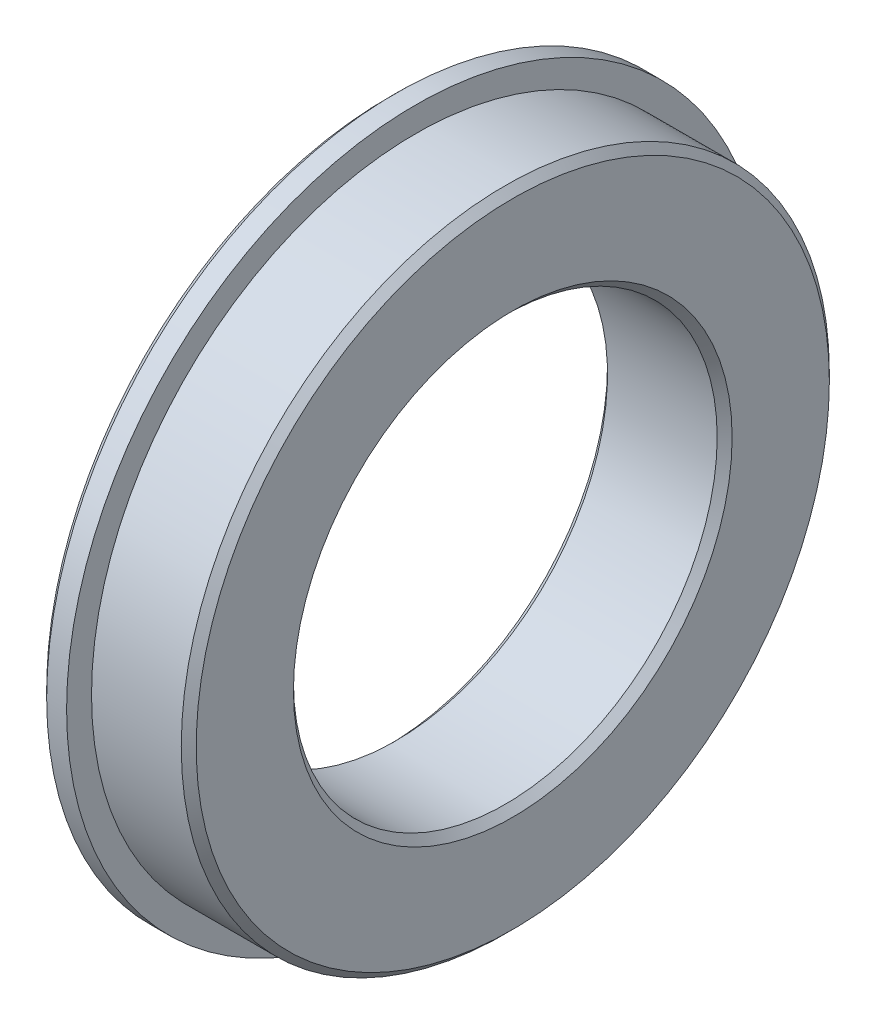
from build123d import *

# Parameters (mm, degrees)
SKETCH_1_R          = 14
SKETCH_1_R_2        = 8.5
EXTRUDE_1_DEPTH     = 5
SKETCH_2_R          = 16.127190563
SKETCH_2_R_2        = 13
CUT_EXTRUDE_1_DEPTH = 3.9
CHAMFER_1_SIZE      = 0.3


with BuildPart() as part:
    # 草图1 → 凸台-拉伸1 (new body)
    with BuildSketch(Plane(origin=(0, 0, 0), x_dir=(0, 0, -1), z_dir=(1, 0, 0))):
        Circle(SKETCH_1_R)
        Circle(SKETCH_1_R_2, mode=Mode.SUBTRACT)
    extrude(amount=EXTRUDE_1_DEPTH)

    # 草图2 → 切除-拉伸1 (cut)
    with BuildSketch(Plane(origin=(5, 0, 0), x_dir=(0, 0, -1), z_dir=(1, 0, 0))):
        Circle(SKETCH_2_R)
        Circle(SKETCH_2_R_2, mode=Mode.SUBTRACT)
    extrude(amount=-CUT_EXTRUDE_1_DEPTH, mode=Mode.SUBTRACT)

    # 倒角1
    chamfer_1_edges = [part.edges().sort_by_distance(p)[0] for p in [
        (5, 0, 13),
        (0, 0, 14),
        (0, 0, 8.5),
        (5, 0, 8.5),
    ]]
    chamfer(chamfer_1_edges, length=CHAMFER_1_SIZE)


solid = part.part
